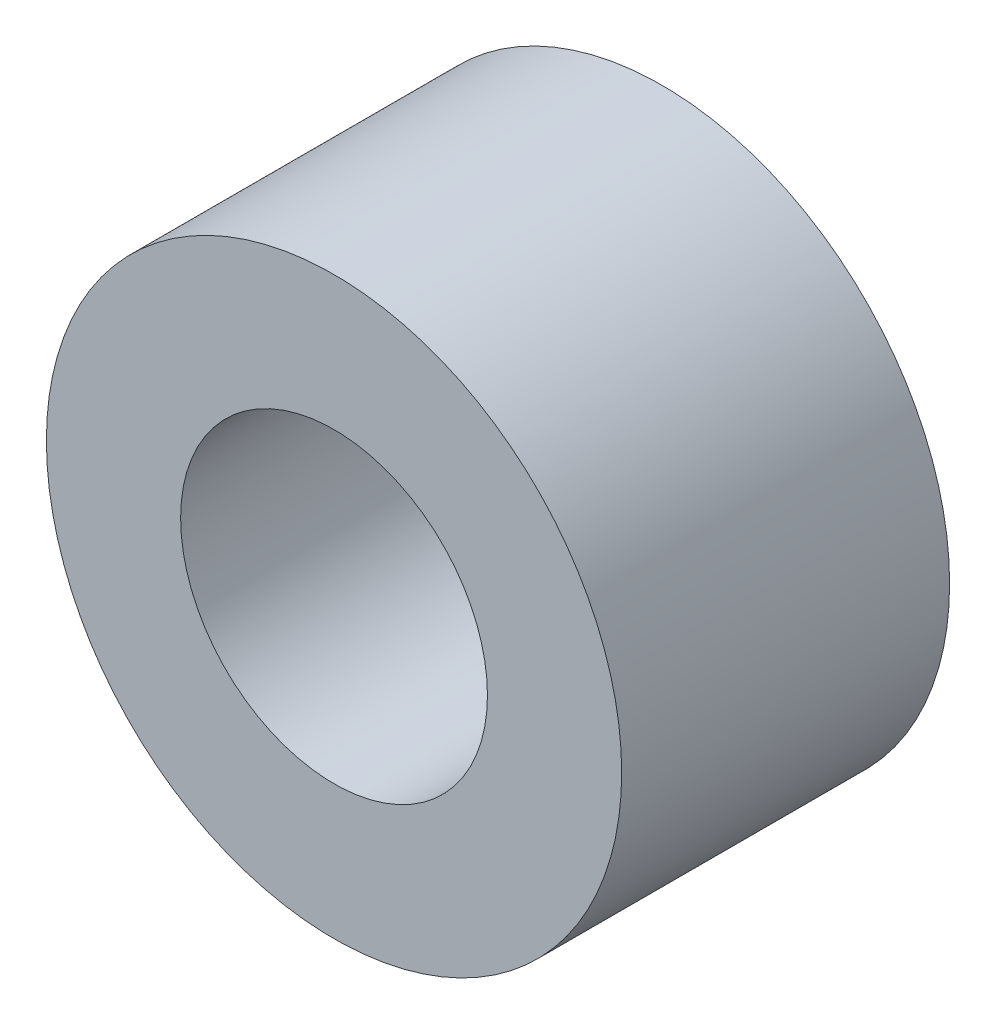
from build123d import *

# Parameters (mm, degrees)
ESQUISSE1_R        = 6
ESQUISSE1_R_2      = 3.2
BOSS_EXTRU_1_DEPTH = 3.42


with BuildPart() as part:
    # Esquisse1 → Boss.-Extru.1 (new, symmetric)
    with BuildSketch(Plane.XY):
        Circle(ESQUISSE1_R)
        Circle(ESQUISSE1_R_2, mode=Mode.SUBTRACT)
    extrude(amount=BOSS_EXTRU_1_DEPTH, both=True)


solid = part.part
